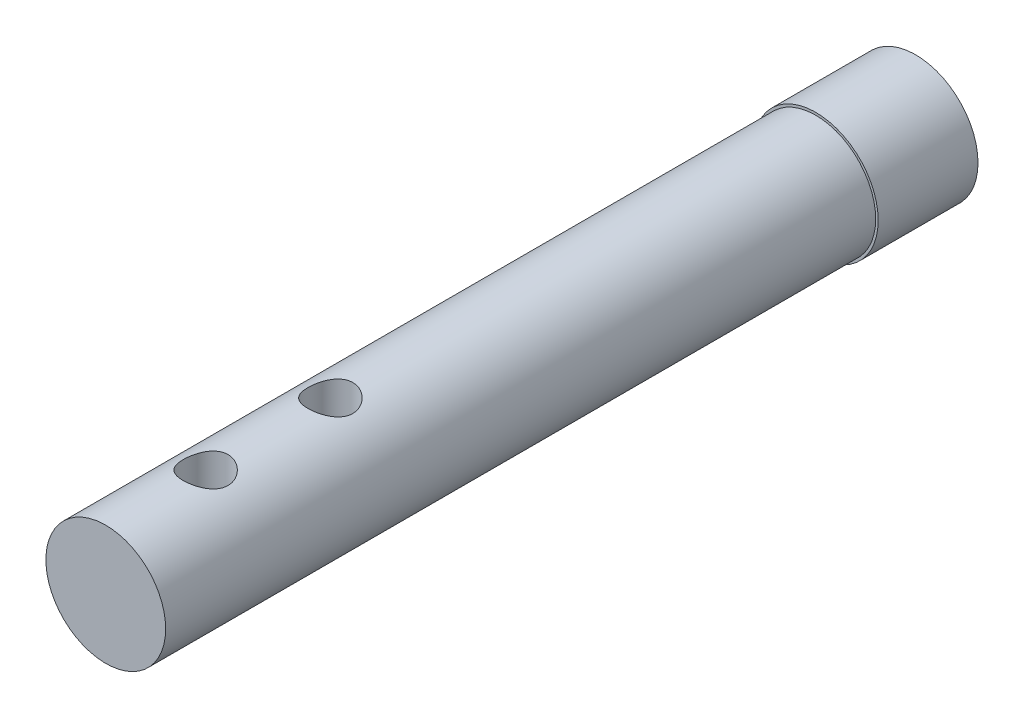
from build123d import *

# Parameters (mm, degrees)
SKETCH1_R               = 10
BOSS_EXTRUDE1_DEPTH     = 15
SKETCH2_R               = 12.5
BOSS_EXTRUDE2_DEPTH     = 20
SKETCH3_R               = 12
BOSS_EXTRUDE3_DEPTH     = 142.26
SKETCH4_R               = 4.5
CUT_EXTRUDE1_DEPTH      = 179.13929269
CUT_EXTRUDE2_DEPTH      = 179.139292789
CUT_EXTRUDE2_DEPTH_BACK = 179.139292789
SKETCH5_W               = 50.129657838
SKETCH5_H               = 19.874218845
LPATTERN1_COUNT         = 2
LPATTERN1_PITCH         = 25


with BuildPart() as part:
    # Sketch1 → Boss-Extrude1 (new body)
    with BuildSketch(Plane.XY):
        Circle(SKETCH1_R)
    extrude(amount=BOSS_EXTRUDE1_DEPTH)

    # Sketch2 → Boss-Extrude2 (add)
    with BuildSketch(Plane.XY.offset(15)):
        Circle(SKETCH2_R)
    extrude(amount=BOSS_EXTRUDE2_DEPTH)

    # Sketch3 → Boss-Extrude3 (add)
    with BuildSketch(Plane.XY.offset(35)):
        Circle(SKETCH3_R)
    extrude(amount=BOSS_EXTRUDE3_DEPTH)

    # Sketch4 → Cut-Extrude1 (cut, symmetric)
    with BuildSketch(Plane(origin=(0, 0, 0), x_dir=(1, 0, 0), z_dir=(0, 1, 0))):
        with Locations(Location((0, -157.26, 0), (0, 0, 270))):
            Circle(SKETCH4_R)
    cut_extrude1 = extrude(amount=CUT_EXTRUDE1_DEPTH, both=True, mode=Mode.SUBTRACT)

    # Sketch5 → Cut-Extrude2 (cut, two sides: drawn at the far end of the back side and taken through both)
    with BuildSketch(Plane(origin=(0, 0, 0), x_dir=(1, 0, 0), z_dir=(0, 1, 0)).offset(-CUT_EXTRUDE2_DEPTH_BACK)):
        with Locations((-12.564828919, -5.062890578)):
            Rectangle(SKETCH5_W, SKETCH5_H)
    extrude(amount=CUT_EXTRUDE2_DEPTH + CUT_EXTRUDE2_DEPTH_BACK, mode=Mode.SUBTRACT)

    # LPattern1: Cut-Extrude1 ×2
    with Locations(*[(0, 0, -i * LPATTERN1_PITCH) for i in range(1, LPATTERN1_COUNT)]):
        add(cut_extrude1, mode=Mode.SUBTRACT)


solid = part.part
